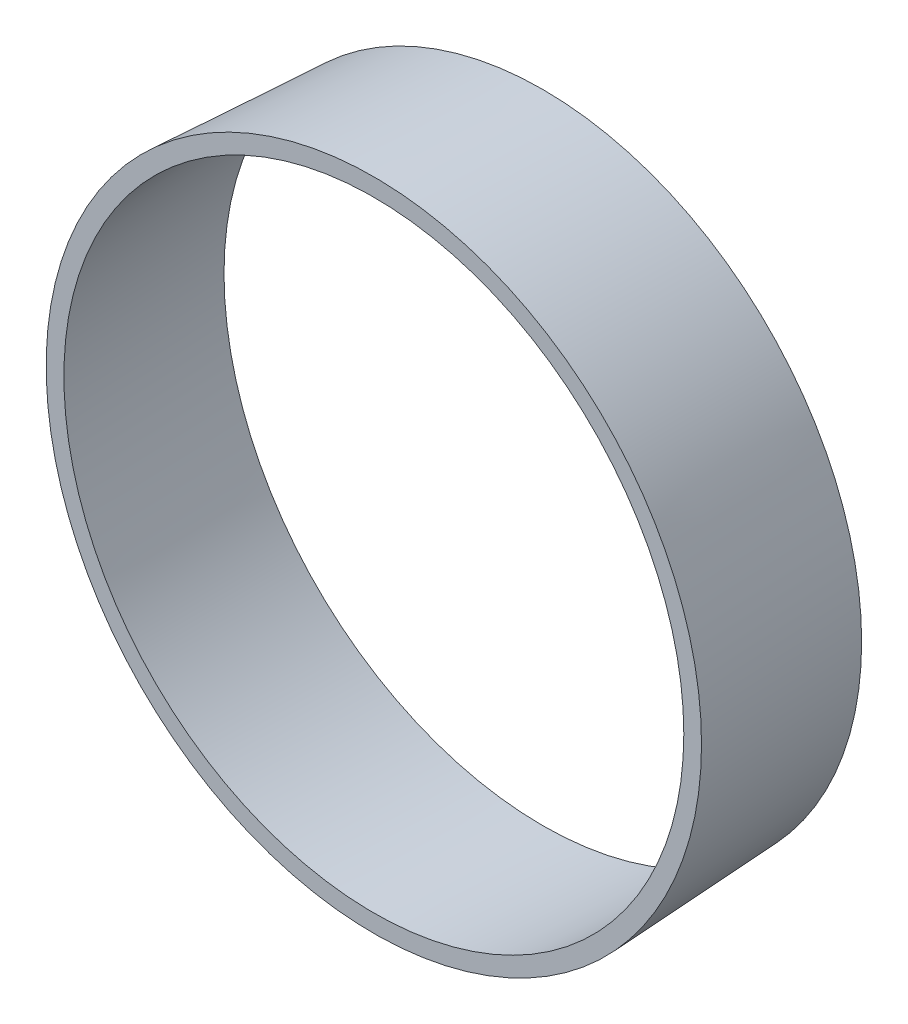
from build123d import *

# Parameters (mm, degrees)
SKETCH2_R           = 18.5
SKETCH2_R_2         = 17.5
EXTRUDE_THIN1_DEPTH = 15
EXTRUDE_THIN1_TAPER = 3


with BuildPart() as part:
    # Sketch2 → Extrude-Thin1 (new body)
    with BuildSketch(Plane.XY):
        Circle(SKETCH2_R)
        Circle(SKETCH2_R_2, mode=Mode.SUBTRACT)
    extrude(amount=-EXTRUDE_THIN1_DEPTH, taper=EXTRUDE_THIN1_TAPER)


solid = part.part
